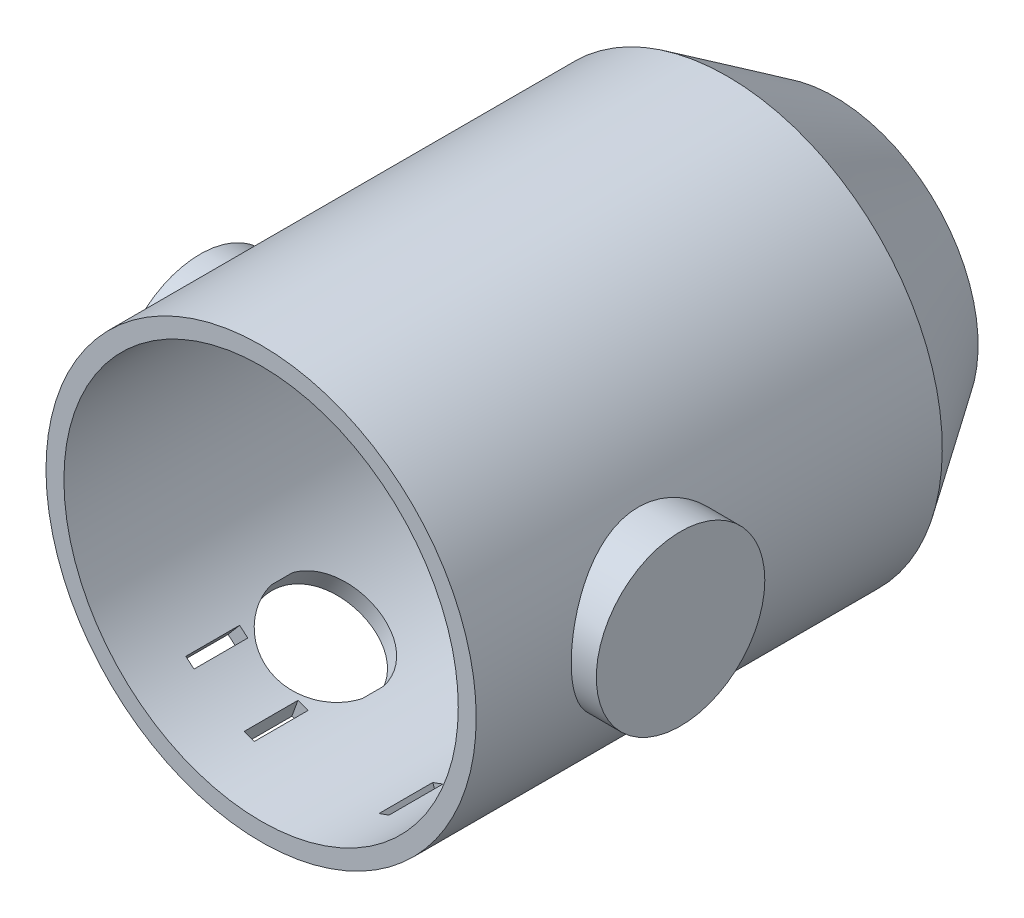
from build123d import *

# Parameters (mm, degrees)
SKETCH1_R                            = 60
BOSS_EXTRUDE1_DEPTH                  = 160
CHAMFER1_SIZE                        = 20
CHAMFER1_SIZE2                       = 30
SHELL2_T                             = -5
SKETCH7_R                            = 15
CUT_EXTRUDE1_DEPTH                   = 7
SKETCH8_R                            = 15
CUT_EXTRUDE2_DEPTH                   = 7
SKETCH9_R                            = 23.5
BOSS_EXTRUDE2_DEPTH                  = 7
BOSS_EXTRUDE2_DIRECTION_2_REACH      = 210.806
BOSS_EXTRUDE2_DIRECTION_2_END_RADIUS = 60
SKETCH10_R                           = 23.5
BOSS_EXTRUDE3_DEPTH                  = 7
BOSS_EXTRUDE3_DIRECTION_2_REACH      = 214.906
BOSS_EXTRUDE3_DIRECTION_2_END_RADIUS = 60
SKETCH12_W                           = 35
SKETCH12_H                           = 40
CUT_EXTRUDE3_DEPTH                   = 32
CUT_EXTRUDE4_REACH                   = 221.026
CUT_EXTRUDE4_END_RADIUS              = 55
SKETCH14_W                           = 3
SKETCH14_H                           = 15
CUT_EXTRUDE5_REACH                   = 218.344
CUT_EXTRUDE5_END_RADIUS              = 55
SKETCH15_W                           = 3
SKETCH15_H                           = 15
CUT_EXTRUDE6_REACH                   = 218.344
CUT_EXTRUDE6_END_RADIUS              = 55
SKETCH16_W                           = 3
SKETCH16_H                           = 15
CUT_EXTRUDE7_REACH                   = 221.026
CUT_EXTRUDE7_END_RADIUS              = 55
SKETCH17_W                           = 3
SKETCH17_H                           = 15
BOSS_EXTRUDE5_REACH                  = 185.546
SKETCH18_R                           = 1.5
BOSS_EXTRUDE5_DIRECTION_2_REACH      = 185.546


with BuildPart() as part:
    # Sketch1 → Boss-Extrude1 (new body)
    with BuildSketch(Plane.XY):
        Circle(SKETCH1_R)
    extrude(amount=BOSS_EXTRUDE1_DEPTH)

    # Chamfer1
    chamfer1_edges = [part.edges().sort_by_distance(p)[0] for p in [
        (-60, 0, 0),
    ]]
    chamfer1_side = [part.faces().sort_by_distance(p)[0] for p in [
        (0, 0, 0),
    ]]
    chamfer(chamfer1_edges, length=CHAMFER1_SIZE, length2=CHAMFER1_SIZE2, reference=chamfer1_side[0])

    # Shell2
    shell2_openings = [part.faces().sort_by_distance(p)[0] for p in [
        (0, 0, 160),
        (0, 0, 0),
    ]]
    offset(amount=SHELL2_T, openings=shell2_openings, kind=Kind.INTERSECTION)

    # Sketch7 → Cut-Extrude1 (cut)
    with BuildSketch(Plane(origin=(-30, -51.961524227, 0), x_dir=(-0.866025403784438, 0.5000000000000011, 0), z_dir=(-0.5000000000000011, -0.866025403784438, 0))):
        with Locations(Location((0, -115, 0), (0, 0, 180))):
            Circle(SKETCH7_R)
    extrude(amount=-CUT_EXTRUDE1_DEPTH, mode=Mode.SUBTRACT)

    # Sketch8 → Cut-Extrude2 (cut)
    with BuildSketch(Plane(origin=(30, -51.961524227, 0), x_dir=(-0.8660254037844451, -0.4999999999999888, 0), z_dir=(0.4999999999999888, -0.8660254037844451, 0))):
        with Locations(Location((0, -115, 0), (0, 0, 180))):
            Circle(SKETCH8_R)
    extrude(amount=-CUT_EXTRUDE2_DEPTH, mode=Mode.SUBTRACT)

    # Sketch9 → Boss-Extrude2 (add)
    with BuildSketch(Plane.ZY.offset(60)):
        with Locations((110, 0)):
            Circle(SKETCH9_R)
    extrude(amount=BOSS_EXTRUDE2_DEPTH)

    # Boss-Extrude2 direction 2: up to this cylinder (the profile starts outside it)
    boss_extrude2_direction_2_end = Plane(origin=(0, 0, 110), z_dir=(0, 0, -1)) * Cylinder(BOSS_EXTRUDE2_DIRECTION_2_END_RADIUS, 542.612, mode=Mode.PRIVATE)
    # Sketch9 → Boss-Extrude2 direction 2 (add, up to the surface)
    with BuildSketch(Plane.ZY.offset(60), mode=Mode.PRIVATE) as boss_extrude2_direction_2_sk1:
        with Locations((110, 0)):
            Circle(SKETCH9_R)
    boss_extrude2_direction_2_tool1 = extrude(boss_extrude2_direction_2_sk1.sketch, amount=-BOSS_EXTRUDE2_DIRECTION_2_REACH, mode=Mode.PRIVATE) - boss_extrude2_direction_2_end
    add(boss_extrude2_direction_2_tool1.solids().sort_by_distance((-60, 0, 110))[0])
    add(boss_extrude2_direction_2_tool1.solids().sort_by_distance((-60, 0, 110))[1])

    # Sketch10 → Boss-Extrude3 (add)
    with BuildSketch(Plane(origin=(60, 0, 0), x_dir=(0, 0, -1), z_dir=(1, 0, 0))):
        with Locations(Location((-110, 0, 0), (0, 0, 180))):
            Circle(SKETCH10_R)
    extrude(amount=BOSS_EXTRUDE3_DEPTH)

    # Boss-Extrude3 direction 2: up to this cylinder (the profile starts outside it)
    boss_extrude3_direction_2_end = Plane(origin=(0, 0, 110), z_dir=(0, 0, -1)) * Cylinder(BOSS_EXTRUDE3_DIRECTION_2_END_RADIUS, 550.812, mode=Mode.PRIVATE)
    # Sketch10 → Boss-Extrude3 direction 2 (add, up to the surface)
    with BuildSketch(Plane(origin=(60, 0, 0), x_dir=(0, 0, -1), z_dir=(1, 0, 0)), mode=Mode.PRIVATE) as boss_extrude3_direction_2_sk1:
        with Locations(Location((-110, 0, 0), (0, 0, 180))):
            Circle(SKETCH10_R)
    boss_extrude3_direction_2_tool1 = extrude(boss_extrude3_direction_2_sk1.sketch, amount=-BOSS_EXTRUDE3_DIRECTION_2_REACH, mode=Mode.PRIVATE) - boss_extrude3_direction_2_end
    add(boss_extrude3_direction_2_tool1.solids().sort_by_distance((60, 0, 110))[0])
    add(boss_extrude3_direction_2_tool1.solids().sort_by_distance((60, 0, 110))[1])

    # Sketch12 → Cut-Extrude3 (cut)
    with BuildSketch(Plane(origin=(0, -60, 0), x_dir=(-1, 0, 0), z_dir=(0, -1, 0))):
        with Locations((0, -20)):
            Rectangle(SKETCH12_W, SKETCH12_H)
    extrude(amount=-CUT_EXTRUDE3_DEPTH, mode=Mode.SUBTRACT)

    # Cut-Extrude4: up to this cylinder (the profile starts outside it)
    cut_extrude4_end = Plane(origin=(0, 0, 137), z_dir=(0, 0, -1)) * Cylinder(CUT_EXTRUDE4_END_RADIUS, 553.052, mode=Mode.PRIVATE)
    # Sketch14 → Cut-Extrude4 (cut, up to the surface)
    with BuildSketch(Plane(origin=(38.567256581, -45.962666587, 0), x_dir=(-0.7660444431189859, -0.6427876096865299, 0), z_dir=(0.6427876096865299, -0.7660444431189859, 0)), mode=Mode.PRIVATE) as cut_extrude4_sk1:
        with Locations((0, -137)):
            Rectangle(SKETCH14_W, SKETCH14_H)
    cut_extrude4_tool1 = extrude(cut_extrude4_sk1.sketch, amount=-CUT_EXTRUDE4_REACH, mode=Mode.PRIVATE) - cut_extrude4_end
    add(cut_extrude4_tool1.solids().sort_by_distance((38.567257, -45.962667, 137))[0], mode=Mode.SUBTRACT)

    # Cut-Extrude5: up to this cylinder (the profile starts outside it)
    cut_extrude5_end = Plane(origin=(0, 0, 137), z_dir=(0, 0, -1)) * Cylinder(CUT_EXTRUDE5_END_RADIUS, 547.688, mode=Mode.PRIVATE)
    # Sketch15 → Cut-Extrude5 (cut, up to the surface)
    with BuildSketch(Plane(origin=(20.5212086, -56.381557247, 0), x_dir=(-0.9396926207859128, -0.3420201433256568, 0), z_dir=(0.3420201433256568, -0.9396926207859128, 0)), mode=Mode.PRIVATE) as cut_extrude5_sk1:
        with Locations((0, -137)):
            Rectangle(SKETCH15_W, SKETCH15_H)
    cut_extrude5_tool1 = extrude(cut_extrude5_sk1.sketch, amount=-CUT_EXTRUDE5_REACH, mode=Mode.PRIVATE) - cut_extrude5_end
    add(cut_extrude5_tool1.solids().sort_by_distance((20.521209, -56.381557, 137))[0], mode=Mode.SUBTRACT)

    # Cut-Extrude6: up to this cylinder (the profile starts outside it)
    cut_extrude6_end = Plane(origin=(0, 0, 137), z_dir=(0, 0, -1)) * Cylinder(CUT_EXTRUDE6_END_RADIUS, 547.688, mode=Mode.PRIVATE)
    # Sketch16 → Cut-Extrude6 (cut, up to the surface)
    with BuildSketch(Plane(origin=(-20.5212086, -56.381557247, 0), x_dir=(-0.9396926207859082, 0.3420201433256693, 0), z_dir=(-0.3420201433256693, -0.9396926207859082, 0)), mode=Mode.PRIVATE) as cut_extrude6_sk1:
        with Locations((0, -137)):
            Rectangle(SKETCH16_W, SKETCH16_H)
    cut_extrude6_tool1 = extrude(cut_extrude6_sk1.sketch, amount=-CUT_EXTRUDE6_REACH, mode=Mode.PRIVATE) - cut_extrude6_end
    add(cut_extrude6_tool1.solids().sort_by_distance((-20.521209, -56.381557, 137))[0], mode=Mode.SUBTRACT)

    # Cut-Extrude7: up to this cylinder (the profile starts outside it)
    cut_extrude7_end = Plane(origin=(0, 0, 137), z_dir=(0, 0, -1)) * Cylinder(CUT_EXTRUDE7_END_RADIUS, 553.052, mode=Mode.PRIVATE)
    # Sketch17 → Cut-Extrude7 (cut, up to the surface)
    with BuildSketch(Plane(origin=(-38.567256581, -45.962666587, 0), x_dir=(-0.7660444431189771, 0.6427876096865406, 0), z_dir=(-0.6427876096865405, -0.766044443118977, 0)), mode=Mode.PRIVATE) as cut_extrude7_sk1:
        with Locations((0, -137)):
            Rectangle(SKETCH17_W, SKETCH17_H)
    cut_extrude7_tool1 = extrude(cut_extrude7_sk1.sketch, amount=-CUT_EXTRUDE7_REACH, mode=Mode.PRIVATE) - cut_extrude7_end
    add(cut_extrude7_tool1.solids().sort_by_distance((-38.567257, -45.962667, 137))[0], mode=Mode.SUBTRACT)

    # Boss-Extrude5: up to this cone (the profile starts inside it)
    boss_extrude5_end = Plane(origin=(0, 0, 2.5), z_dir=(0, 0, 1)).offset(-53.486120811) * Cone(1e-06, 183.459690901, 275.189535352, align=(Align.CENTER, Align.CENTER, Align.MIN), mode=Mode.PRIVATE)
    # Sketch18 → Boss-Extrude5 (add, up to the surface)
    with BuildSketch(Plane(origin=(0, 0, 0), x_dir=(0, 0, -1), z_dir=(1, 0, 0)), mode=Mode.PRIVATE) as boss_extrude5_sk1:
        with Locations(Location((-2.5, -10.5, 0), (0, 0, 212.572301633))):
            Circle(SKETCH18_R)
    boss_extrude5_tool1 = extrude(boss_extrude5_sk1.sketch, amount=BOSS_EXTRUDE5_REACH, mode=Mode.PRIVATE) & boss_extrude5_end
    add(boss_extrude5_tool1.solids().sort_by_distance((0, -10.5, 2.5))[0])

    # Boss-Extrude5 direction 2: up to this cone (the profile starts inside it)
    boss_extrude5_direction_2_end = Plane(origin=(0, 0, 2.5), z_dir=(0, 0, 1)).offset(-53.486120811) * Cone(1e-06, 183.459690901, 275.189535352, align=(Align.CENTER, Align.CENTER, Align.MIN), mode=Mode.PRIVATE)
    # Sketch18 → Boss-Extrude5 direction 2 (add, up to the surface)
    with BuildSketch(Plane(origin=(0, 0, 0), x_dir=(0, 0, -1), z_dir=(1, 0, 0)), mode=Mode.PRIVATE) as boss_extrude5_direction_2_sk1:
        with Locations(Location((-2.5, -10.5, 0), (0, 0, 212.572301633))):
            Circle(SKETCH18_R)
    boss_extrude5_direction_2_tool1 = extrude(boss_extrude5_direction_2_sk1.sketch, amount=-BOSS_EXTRUDE5_DIRECTION_2_REACH, mode=Mode.PRIVATE) & boss_extrude5_direction_2_end
    add(boss_extrude5_direction_2_tool1.solids().sort_by_distance((0, -10.5, 2.5))[0])


solid = part.part
